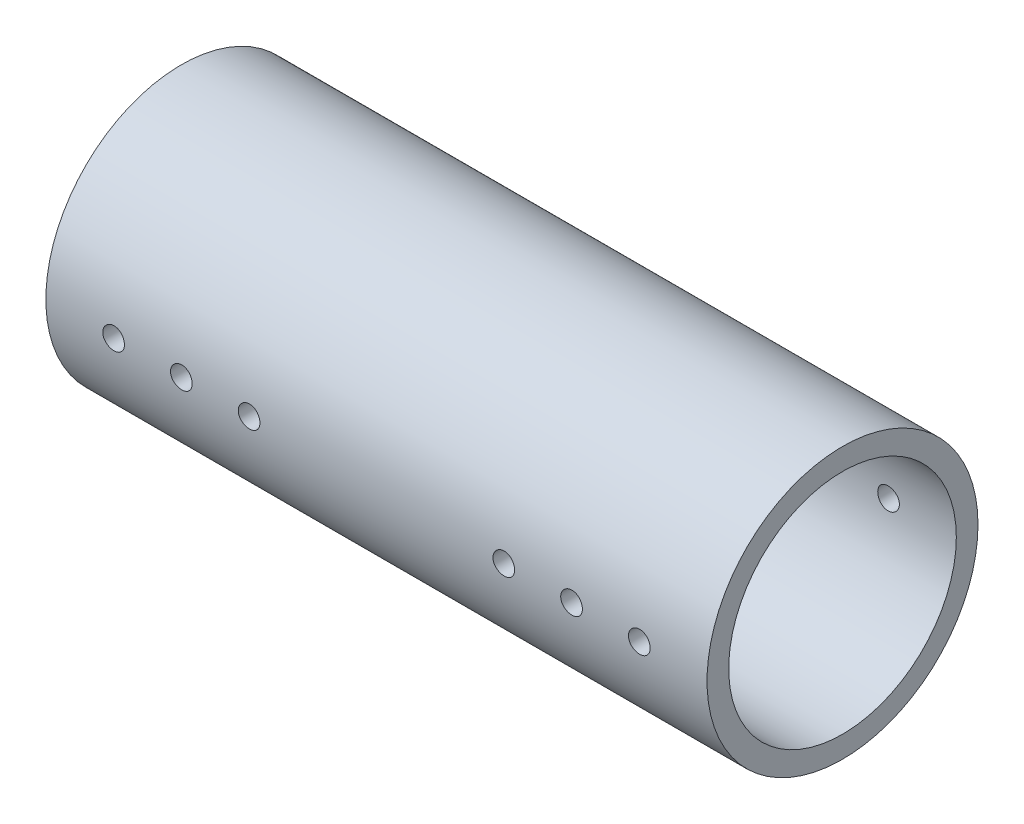
from build123d import *

# Parameters (mm, degrees)
SKETCH_2_R               = 25
SKETCH_2_R_2             = 21
EXTRUDE_2_DEPTH          = 122
CUT_EXTRUDE_2_DEPTH      = 10
CUT_EXTRUDE_2_DEPTH_BACK = 135.197615478
SKETCH_4_R               = 2


with BuildPart() as part:
    # Эскиз2 → Бобышка-Вытянуть2 (new body)
    with BuildSketch(Plane(origin=(0, 0, 0), x_dir=(0, 0, -1), z_dir=(1, 0, 0))):
        Circle(SKETCH_2_R)
        Circle(SKETCH_2_R_2, mode=Mode.SUBTRACT)
    extrude(amount=EXTRUDE_2_DEPTH)

    # Эскиз4 → Вырез-Вытянуть2 (cut, two sides: drawn at the far end of the back side and taken through both)
    with BuildSketch(Plane.XY.offset(25).offset(-CUT_EXTRUDE_2_DEPTH_BACK)):
        with Locations((12.5, 0)):
            Circle(SKETCH_4_R)
        with Locations((109.5, 0)):
            Circle(SKETCH_4_R)
        with Locations((25, 0)):
            Circle(SKETCH_4_R)
        with Locations((37.5, 0)):
            Circle(SKETCH_4_R)
        with Locations((97, 0)):
            Circle(SKETCH_4_R)
        with Locations((84.5, 0)):
            Circle(SKETCH_4_R)
    extrude(amount=CUT_EXTRUDE_2_DEPTH + CUT_EXTRUDE_2_DEPTH_BACK, mode=Mode.SUBTRACT)


solid = part.part
